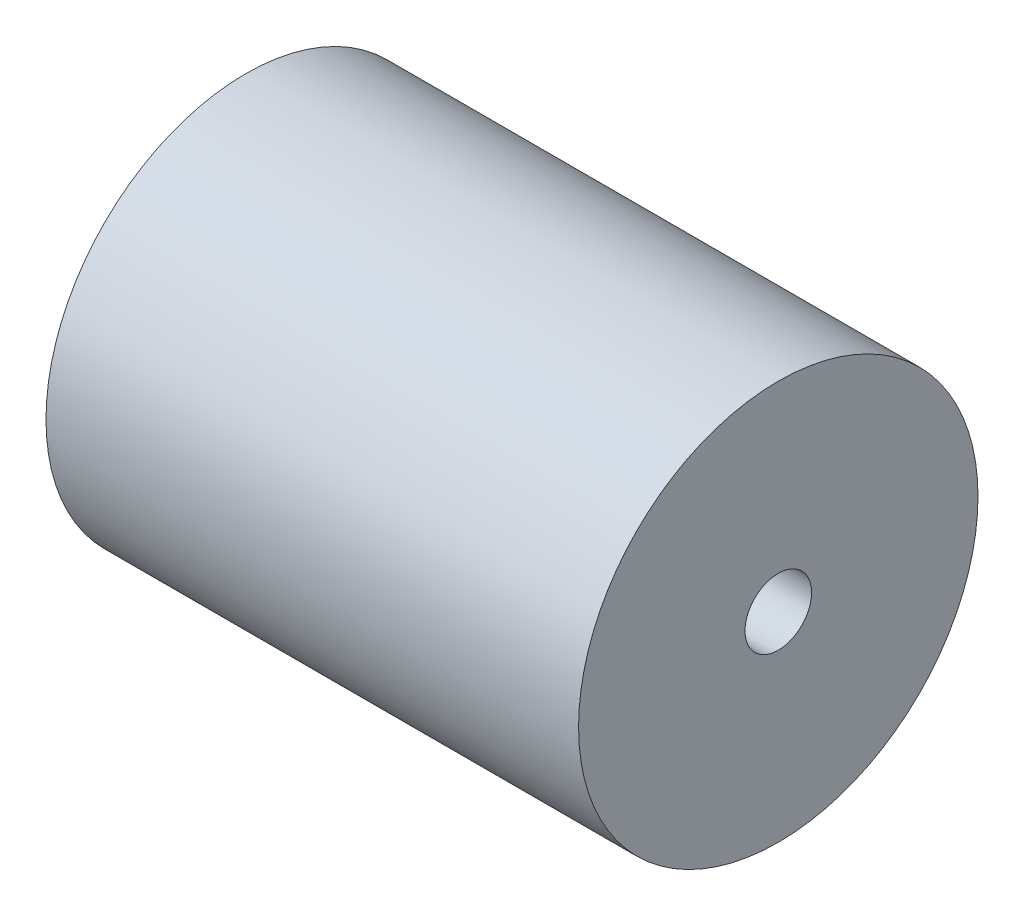
from build123d import *

# Parameters (mm, degrees)
SKETCH1_R           = 1.5
BOSS_EXTRUDE1_DEPTH = 4
SKETCH2_R           = 0.25
CUT_EXTRUDE1_DEPTH  = 4


with BuildPart() as part:
    # Sketch1 → Boss-Extrude1 (new body)
    with BuildSketch(Plane(origin=(0, 0, 0), x_dir=(0, 0, -1), z_dir=(1, 0, 0))):
        Circle(SKETCH1_R)
    extrude(amount=BOSS_EXTRUDE1_DEPTH)

    # Sketch2 → Cut-Extrude1 (cut)
    with BuildSketch(Plane(origin=(4, 0, 0), x_dir=(0, 0, -1), z_dir=(1, 0, 0))):
        Circle(SKETCH2_R)
    extrude(amount=-CUT_EXTRUDE1_DEPTH, mode=Mode.SUBTRACT)


solid = part.part
